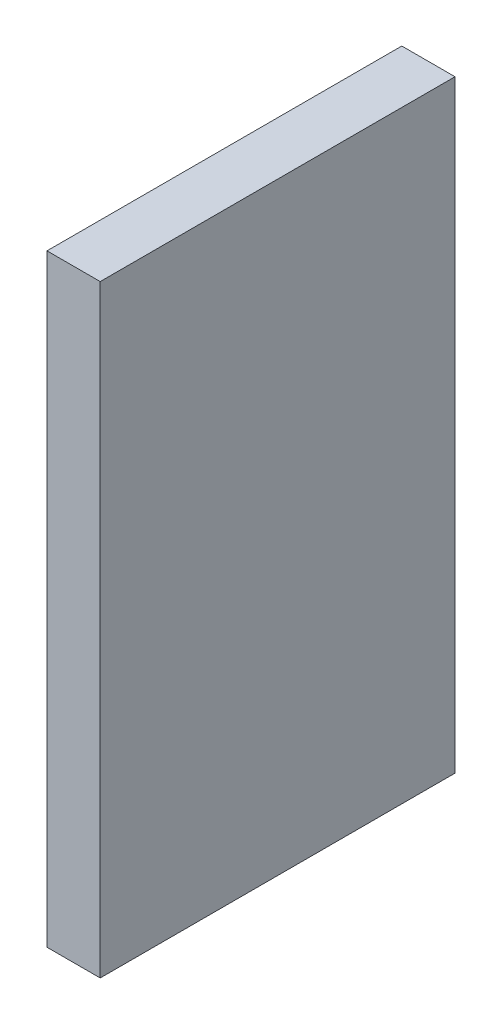
from build123d import *

# Parameters (mm, degrees)
ESQUISSE1_W        = 15
ESQUISSE1_H        = 100
BOSS_EXTRU_1_DEPTH = 170


with BuildPart() as part:
    # Esquisse1 → Boss.-Extru.1 (new body)
    with BuildSketch(Plane(origin=(0, 0, 0), x_dir=(1, 0, 0), z_dir=(0, 1, 0))):
        with Locations((-28.974245753, 8.764401031)):
            Rectangle(ESQUISSE1_W, ESQUISSE1_H)
    extrude(amount=BOSS_EXTRU_1_DEPTH)


solid = part.part
